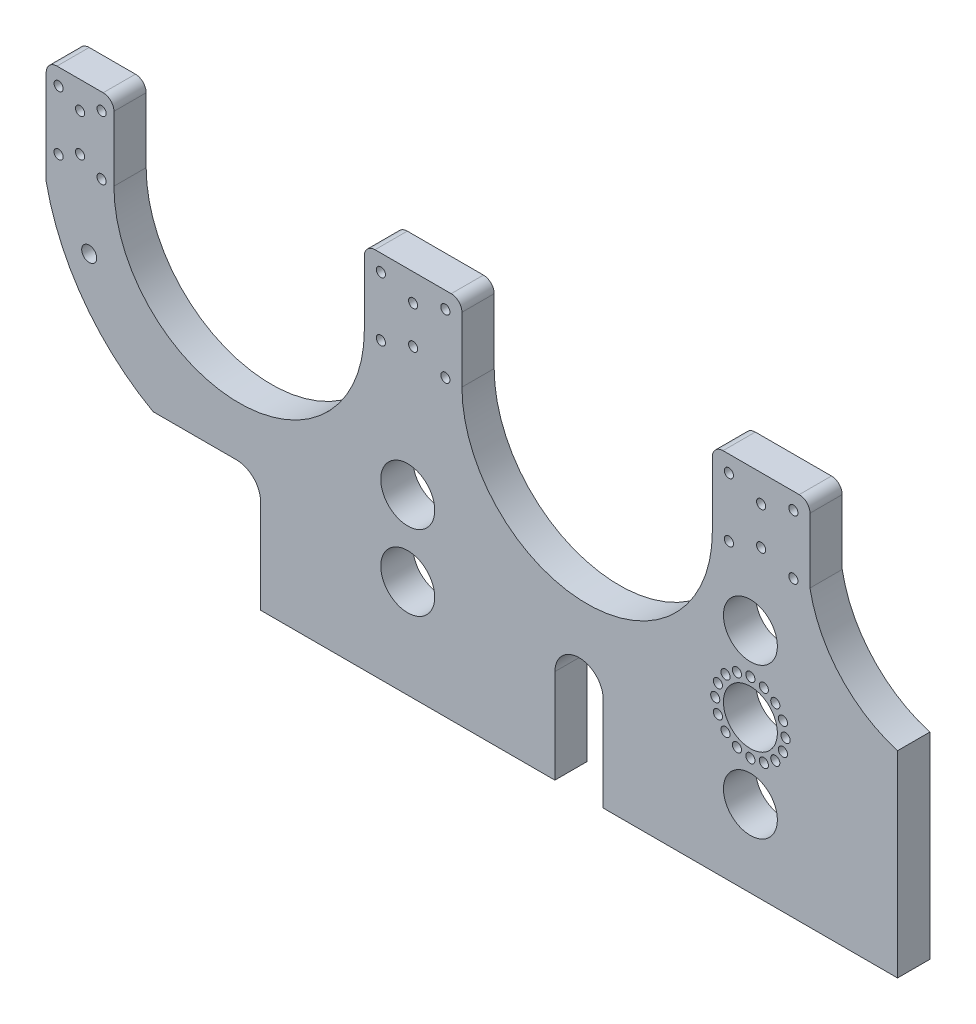
from build123d import *

# Parameters (mm, degrees)
SKETCH1_R           = 25.1
SKETCH1_R_2         = 4.25
SKETCH1_R_3         = 7
BOSS_EXTRUDE1_DEPTH = 30
FILLET1_R           = 10


with BuildPart() as part:
    # Sketch1 → Boss-Extrude1 (new body)
    with BuildSketch(Plane.XY):
        with BuildLine():
            Line((0, 0), (273.87, 0))
            Line((273.87, 0), (273.87, 87.5))
            ThreePointArc((273.87, 87.5), (296.37, 110), (318.87, 87.5))
            Line((318.87, 87.5), (318.87, 0))
            Line((318.87, 0), (592.74, 0))
            Line((592.74, 0), (592.74, 183.19))
            ThreePointArc((592.74, 183.19), (539.268887609, 216.858597344), (511.24, 273.49))
            Line((511.24, 273.49), (511.24, 343.821274963))
            Line((511.24, 343.821274963), (420.37, 343.821274963))
            Line((420.37, 343.821274963), (420.37, 273.49))
            ThreePointArc((420.37, 273.49), (303.87, 156.99), (187.37, 273.49))
            Line((187.37, 273.49), (187.37, 343.821274963))
            Line((187.37, 343.821274963), (96.5, 343.821274963))
            Line((96.5, 343.821274963), (96.5, 273.49))
            ThreePointArc((96.5, 273.49), (-20, 156.99), (-136.5, 273.49))
            Line((-136.5, 273.49), (-136.5, 343.821274963))
            Line((-136.5, 343.821274963), (-199.5, 343.821274963))
            Line((-199.5, 343.821274963), (-199.5, 245.650292451))
            ThreePointArc((-199.5, 245.650292451), (-164.551393078, 166.968268701), (-100, 110))
            Line((-100, 110), (-22.5, 110))
            ThreePointArc((-22.5, 110), (-6.590097423, 103.409902577), (0, 87.5))
            Line((0, 87.5), (0, 0))
        make_face()
        with Locations((455.81, 71.5)):
            Circle(SKETCH1_R, mode=Mode.SUBTRACT)
        with Locations((455.81, 211.5)):
            Circle(SKETCH1_R, mode=Mode.SUBTRACT)
        with Locations((136.93, 91.5)):
            Circle(SKETCH1_R, mode=Mode.SUBTRACT)
        with Locations((136.93, 161.5)):
            Circle(SKETCH1_R, mode=Mode.SUBTRACT)
        with Locations((-188, 328.49)):
            Circle(SKETCH1_R_2, mode=Mode.SUBTRACT)
        with Locations((-188, 273.49)):
            Circle(SKETCH1_R_2, mode=Mode.SUBTRACT)
        with Locations((-148, 328.49)):
            Circle(SKETCH1_R_2, mode=Mode.SUBTRACT)
        with Locations((-148, 273.49)):
            Circle(SKETCH1_R_2, mode=Mode.SUBTRACT)
        with Locations((111.935, 328.49)):
            Circle(SKETCH1_R_2, mode=Mode.SUBTRACT)
        with Locations((171.935, 328.49)):
            Circle(SKETCH1_R_2, mode=Mode.SUBTRACT)
        with Locations((171.935, 273.49)):
            Circle(SKETCH1_R_2, mode=Mode.SUBTRACT)
        with Locations((111.935, 273.49)):
            Circle(SKETCH1_R_2, mode=Mode.SUBTRACT)
        with Locations((495.805, 328.49)):
            Circle(SKETCH1_R_2, mode=Mode.SUBTRACT)
        with Locations((435.805, 328.49)):
            Circle(SKETCH1_R_2, mode=Mode.SUBTRACT)
        with Locations((495.805, 273.49)):
            Circle(SKETCH1_R_2, mode=Mode.SUBTRACT)
        with Locations((435.805, 273.49)):
            Circle(SKETCH1_R_2, mode=Mode.SUBTRACT)
        with Locations((-159.5, 207.5)):
            Circle(SKETCH1_R_3, mode=Mode.SUBTRACT)
        with Locations((-168, 318.49)):
            Circle(SKETCH1_R_2, mode=Mode.SUBTRACT)
        with Locations(Location((-168, 283.49, 0), (0, 0, 180))):
            Circle(SKETCH1_R_2, mode=Mode.SUBTRACT)
        with Locations((141.935, 318.49)):
            Circle(SKETCH1_R_2, mode=Mode.SUBTRACT)
        with Locations(Location((141.935, 283.49, 0), (0, 0, 180))):
            Circle(SKETCH1_R_2, mode=Mode.SUBTRACT)
        with Locations(Location((465.805, 283.49, 0), (0, 0, 180))):
            Circle(SKETCH1_R_2, mode=Mode.SUBTRACT)
        with Locations((465.805, 318.49)):
            Circle(SKETCH1_R_2, mode=Mode.SUBTRACT)
        with Locations((455.81, 141.5)):
            Circle(SKETCH1_R, mode=Mode.SUBTRACT)
        with Locations((455.81, 174.25)):
            Circle(SKETCH1_R_2, mode=Mode.SUBTRACT)
        with Locations((468.34288241, 171.75705469)):
            Circle(SKETCH1_R_2, mode=Mode.SUBTRACT)
        with Locations((478.967747084, 164.657747084)):
            Circle(SKETCH1_R_2, mode=Mode.SUBTRACT)
        with Locations((486.06705469, 154.03288241)):
            Circle(SKETCH1_R_2, mode=Mode.SUBTRACT)
        with Locations((488.56, 141.5)):
            Circle(SKETCH1_R_2, mode=Mode.SUBTRACT)
        with Locations((486.06705469, 128.96711759)):
            Circle(SKETCH1_R_2, mode=Mode.SUBTRACT)
        with Locations((478.967747084, 118.342252916)):
            Circle(SKETCH1_R_2, mode=Mode.SUBTRACT)
        with Locations((468.34288241, 111.24294531)):
            Circle(SKETCH1_R_2, mode=Mode.SUBTRACT)
        with Locations((455.81, 108.75)):
            Circle(SKETCH1_R_2, mode=Mode.SUBTRACT)
        with Locations((443.27711759, 111.24294531)):
            Circle(SKETCH1_R_2, mode=Mode.SUBTRACT)
        with Locations((432.652252916, 118.342252916)):
            Circle(SKETCH1_R_2, mode=Mode.SUBTRACT)
        with Locations((425.55294531, 128.96711759)):
            Circle(SKETCH1_R_2, mode=Mode.SUBTRACT)
        with Locations((423.06, 141.5)):
            Circle(SKETCH1_R_2, mode=Mode.SUBTRACT)
        with Locations((425.55294531, 154.03288241)):
            Circle(SKETCH1_R_2, mode=Mode.SUBTRACT)
        with Locations((432.652252916, 164.657747084)):
            Circle(SKETCH1_R_2, mode=Mode.SUBTRACT)
        with Locations((443.27711759, 171.75705469)):
            Circle(SKETCH1_R_2, mode=Mode.SUBTRACT)
    extrude(amount=BOSS_EXTRUDE1_DEPTH)

    # Fillet1
    fillet1_edges = [part.edges().sort_by_distance(p)[0] for p in [
        (-199.5, 343.821274963, 15),
        (-136.5, 343.821274963, 15),
        (96.5, 343.821274963, 15),
        (187.37, 343.821274963, 15),
        (420.37, 343.821274963, 15),
        (511.24, 343.821274963, 15),
    ]]
    fillet(fillet1_edges, radius=FILLET1_R)


solid = part.part
